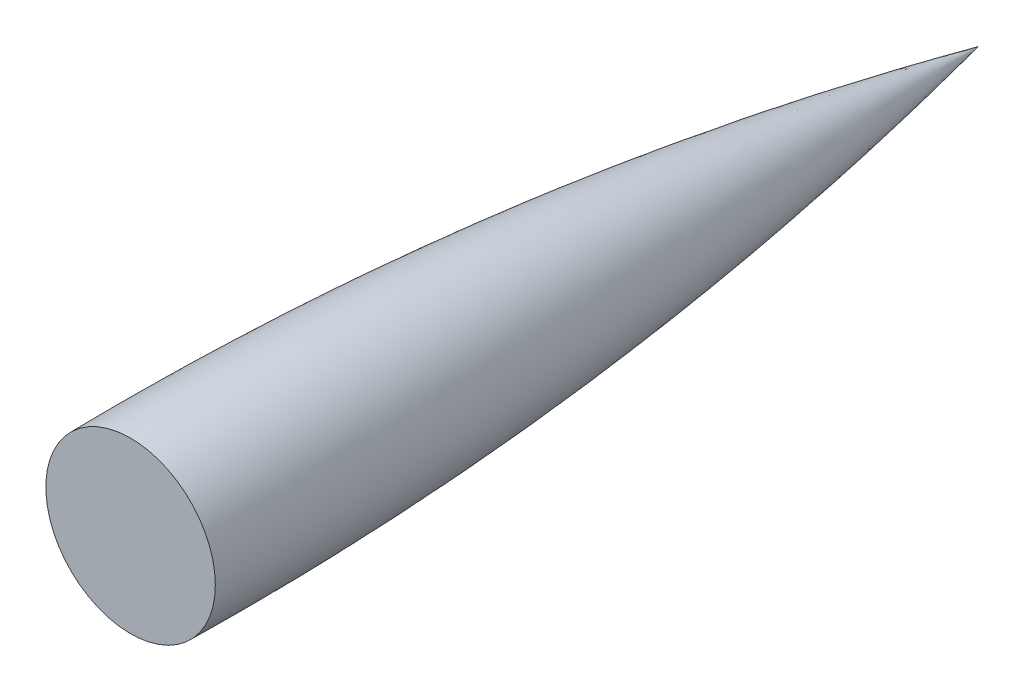
from build123d import *


with BuildPart() as part:
    # Sketch1 → Revolve2 (revolve)
    with BuildSketch(Plane(origin=(0, 0, 0), x_dir=(1, 0, 0), z_dir=(0, 1, 0))):
        with BuildLine():
            Line((0, 0), (50.8, 0))
            ThreePointArc((50.8, 0), (39.71486732, 255.431486732), (0, 508))
            Line((0, 508), (0, 0))
        make_face()
    revolve(axis=Axis((0, 0, 0), (0, 0, -1)))


solid = part.part
